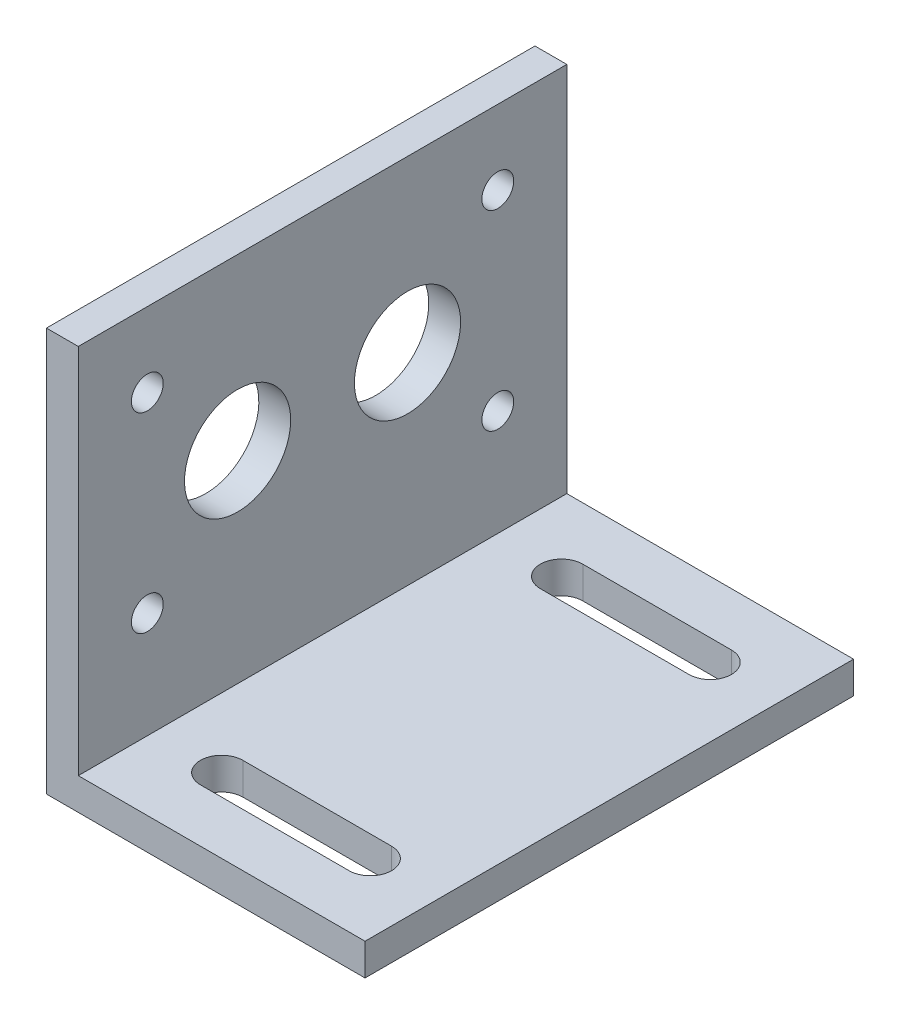
from build123d import *

# Parameters (mm, degrees)
EXTRUDE_1_DEPTH     = 46
SKETCH_2_R          = 1.5
SKETCH_2_R_2        = 5
CUT_EXTRUDE_1_DEPTH = 56
CUT_EXTRUDE_2_DEPTH = 56


with BuildPart() as part:
    # 草图1 → 凸台-拉伸1 (new body)
    with BuildSketch(Plane.XY):
        Polygon((0, 0), (30, 0), (30, 3), (3, 3), (3, 38), (0, 38), align=None)
    extrude(amount=EXTRUDE_1_DEPTH)

    # 草图2 → 切除-拉伸1 (cut)
    with BuildSketch(Plane(origin=(3, 0, 0), x_dir=(0, 0, -1), z_dir=(1, 0, 0))):
        with Locations(Location((-39.5, 31, 0), (0, 0, 90))):
            Circle(SKETCH_2_R)
        with Locations(Location((-39.5, 13, 0), (0, 0, 90))):
            Circle(SKETCH_2_R)
        with Locations(Location((-6.5, 31, 0), (0, 0, 90))):
            Circle(SKETCH_2_R)
        with Locations(Location((-6.5, 13, 0), (0, 0, 90))):
            Circle(SKETCH_2_R)
        with Locations(Location((-31, 22, 0), (0, 0, 90))):
            Circle(SKETCH_2_R_2)
        with Locations(Location((-15, 22, 0), (0, 0, 90))):
            Circle(SKETCH_2_R_2)
    extrude(amount=-CUT_EXTRUDE_1_DEPTH, mode=Mode.SUBTRACT)

    # 草图3 → 切除-拉伸2 (cut)
    with BuildSketch(Plane(origin=(0, 3, 0), x_dir=(1, 0, 0), z_dir=(0, 1, 0))):
        with BuildLine():
            Line((9.5, -5), (23.5, -5))
            ThreePointArc((23.5, -5), (25.5, -7), (23.5, -9))
            Line((23.5, -9), (9.5, -9))
            ThreePointArc((9.5, -9), (7.5, -7), (9.5, -5))
        make_face()
        with BuildLine():
            Line((9.5, -37), (23.5, -37))
            ThreePointArc((23.5, -37), (25.5, -39), (23.5, -41))
            Line((23.5, -41), (9.5, -41))
            ThreePointArc((9.5, -41), (7.5, -39), (9.5, -37))
        make_face()
    extrude(amount=-CUT_EXTRUDE_2_DEPTH, mode=Mode.SUBTRACT)


solid = part.part
